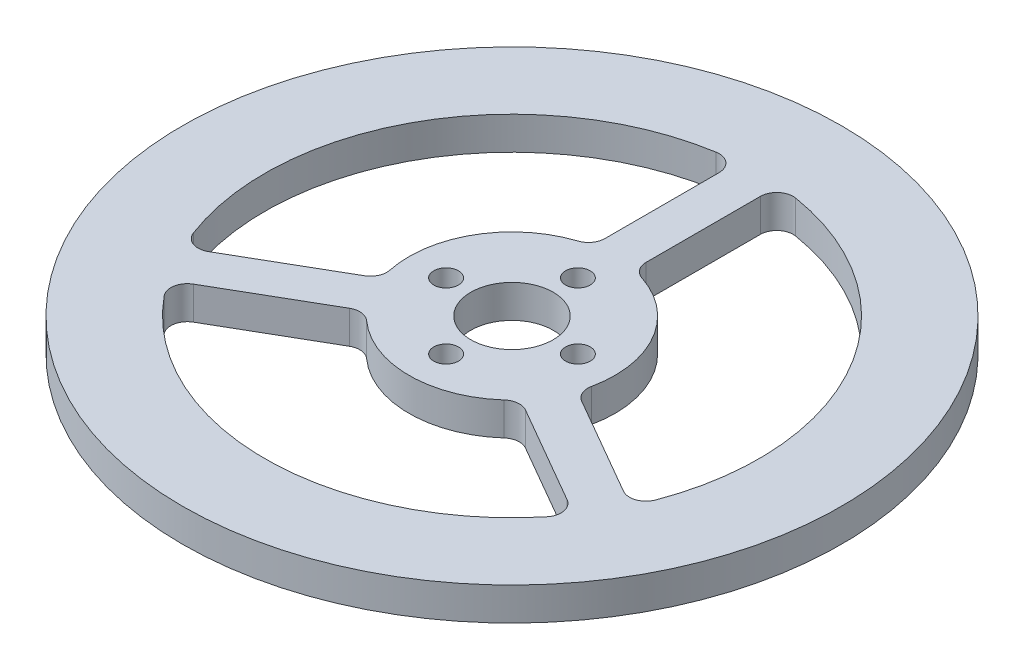
from build123d import *

# Parameters (mm, degrees)
ESBO_O1_R                = 40
ESBO_O1_R_2              = 1.5
ESBO_O1_R_3              = 5
RESSALTO_EXTRUS_O1_DEPTH = 4


with BuildPart() as part:
    # Esboço1 → Ressalto-extrusão1 (new body)
    with BuildSketch(Plane(origin=(0, 4, 0), x_dir=(1, 0, 0), z_dir=(0, 1, 0))):
        with Locations(Location((0, 0, 0), (0, 0, 90))):
            Circle(ESBO_O1_R)
        with Locations(Location((-8, 0, 0), (0, 0, 90))):
            Circle(ESBO_O1_R_2, mode=Mode.SUBTRACT)
        with Locations(Location((0, -8, 0), (0, 0, 90))):
            Circle(ESBO_O1_R_2, mode=Mode.SUBTRACT)
        with Locations(Location((8, 0, 0), (0, 0, 90))):
            Circle(ESBO_O1_R_2, mode=Mode.SUBTRACT)
        with Locations(Location((0, 8, 0), (0, 0, 90))):
            Circle(ESBO_O1_R_2, mode=Mode.SUBTRACT)
        with Locations(Location((0, 0, 0), (0, 0, 90))):
            Circle(ESBO_O1_R_3, mode=Mode.SUBTRACT)
        with BuildLine():
            Line((-2.5, 27.636027211), (-2.5, 13.784048752))
            ThreePointArc((-2.5, 13.784048752), (-2.881145573, 12.609608313), (-3.879310345, 11.882800648))
            ThreePointArc((-3.879310345, 11.882800648), (-10.825317547, 6.25), (-12.230462402, -2.581819016))
            ThreePointArc((-12.230462402, -2.581819016), (-12.360813917, -3.809658898), (-13.187336386, -4.726960867))
            Line((-13.187336386, -4.726960867), (-25.183501624, -11.652950096))
            ThreePointArc((-25.183501624, -11.652950096), (-26.855199812, -11.804730901), (-28.05375174, -10.629534952))
            ThreePointArc((-28.05375174, -10.629534952), (-25.980762114, 15), (-4.821428571, 29.610029155))
            ThreePointArc((-4.821428571, 29.610029155), (-3.204403061, 29.159650711), (-2.5, 27.636027211))
        make_face(mode=Mode.SUBTRACT)
        with BuildLine():
            Line((25.183501624, -11.652950096), (13.187336386, -4.726960867))
            ThreePointArc((13.187336386, -4.726960867), (12.360813917, -3.809658898), (12.230462402, -2.581819016))
            ThreePointArc((12.230462402, -2.581819016), (10.825317547, 6.25), (3.879310345, 11.882800648))
            ThreePointArc((3.879310345, 11.882800648), (2.881145573, 12.609608313), (2.5, 13.784048752))
            Line((2.5, 13.784048752), (2.5, 27.636027211))
            ThreePointArc((2.5, 27.636027211), (3.204403061, 29.159650711), (4.821428571, 29.610029155))
            ThreePointArc((4.821428571, 29.610029155), (25.980762114, 15), (28.05375174, -10.629534952))
            ThreePointArc((28.05375174, -10.629534952), (26.855199812, -11.804730901), (25.183501624, -11.652950096))
        make_face(mode=Mode.SUBTRACT)
        with BuildLine():
            Line((10.687336386, -9.057087886), (22.683501624, -15.983077115))
            ThreePointArc((22.683501624, -15.983077115), (23.650796751, -17.35491981), (23.232323169, -18.980494203))
            ThreePointArc((23.232323169, -18.980494203), (0, -30), (-23.232323169, -18.980494203))
            ThreePointArc((-23.232323169, -18.980494203), (-23.650796751, -17.35491981), (-22.683501624, -15.983077115))
            Line((-22.683501624, -15.983077115), (-10.687336386, -9.057087886))
            ThreePointArc((-10.687336386, -9.057087886), (-9.479668344, -8.799949415), (-8.351152057, -9.300981632))
            ThreePointArc((-8.351152057, -9.300981632), (0, -12.5), (8.351152057, -9.300981632))
            ThreePointArc((8.351152057, -9.300981632), (9.479668344, -8.799949415), (10.687336386, -9.057087886))
        make_face(mode=Mode.SUBTRACT)
    extrude(amount=-RESSALTO_EXTRUS_O1_DEPTH)


solid = part.part
